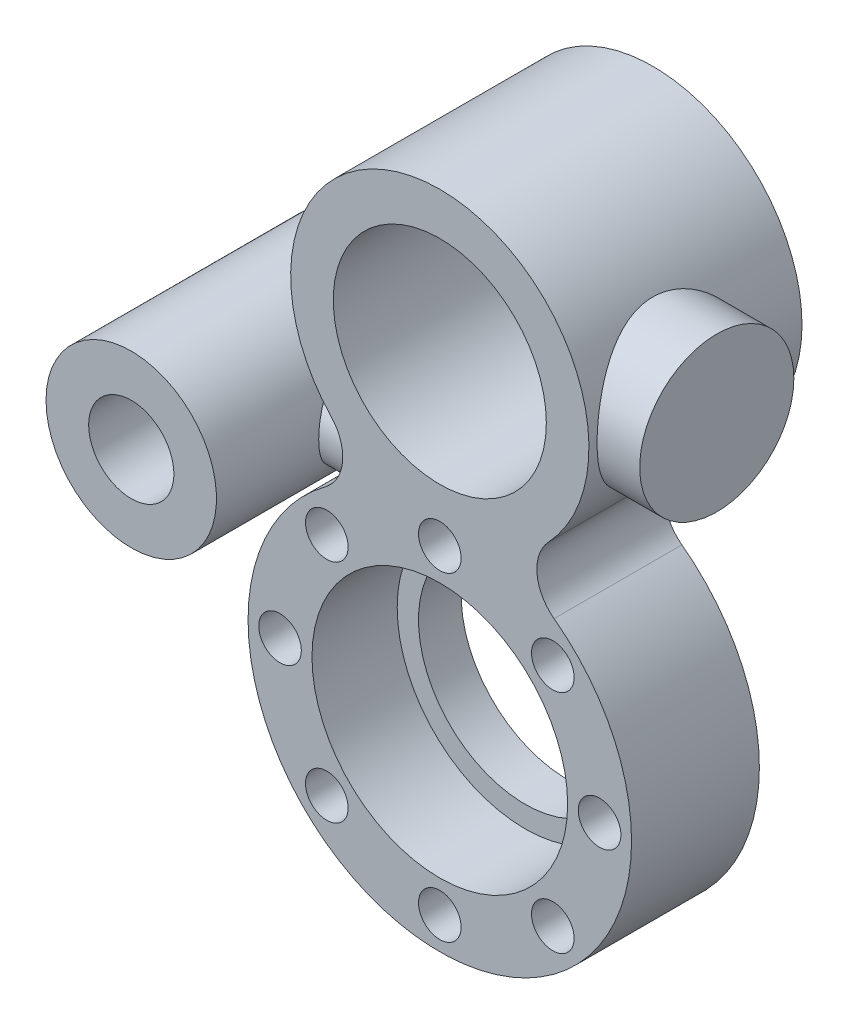
from build123d import *

# Parameters (mm, degrees)
MOTOR_START                     = -30
MOTOR_HOLDER_DEPTH              = 50
SKETCH11_R                      = 5
SCREW_HOLES_DEPTH               = 109.397416943
FILLET1_R                       = 10
BOSS_EXTRUDE4_DEPTH             = 10
BOSS_EXTRUDE4_DEPTH_BACK        = 10
SKETCH14_R                      = 18.090252651
BOSS_EXTRUDE5_REACH             = 122.52
SKETCH17_R                      = 10
BOSS_EXTRUDE5_DIRECTION_2_DEPTH = 1
BOSS_EXTRUDE6_DEPTH             = 10
BOSS_EXTRUDE6_DEPTH_BACK        = 44
SKETCH18_R                      = 20
SKETCH18_R_2                    = 10


with BuildPart() as part:
    # Sketch1 → motor holder (new body)
    with BuildSketch(Plane.XY.offset(MOTOR_START)):
        with BuildLine():
            Line((-35, 35), (-25, 35))
            ThreePointArc((-25, 35), (0, 10), (25, 35))
            Line((25, 35), (35, 35))
            ThreePointArc((35, 35), (0, 0), (-35, 35))
        make_face()
    motor_holder = extrude(amount=MOTOR_HOLDER_DEPTH)

    # Mirror1: motor holder across plane
    add(motor_holder.mirror(Plane(origin=(25, 35, -30), x_dir=(0, 0, 1), z_dir=(0, -1, 0))))

    # Sketch10 → bearing holder (revolve)
    with BuildSketch(Plane(origin=(0, 0, 0), x_dir=(0, 0, -1), z_dir=(1, 0, 0))):
        Polygon((-20, 5), (-20, -10), (0, -10), (0, -15), (10, -15), (10, 5), align=None)
    revolve(axis=Axis((0, -40, 67.918923046), (0, 0, -1)))

    # Sketch11 → screw holes (cut, through all)
    with BuildSketch(Plane.XY.offset(20)):
        with Locations((0, -77.5)):
            Circle(SKETCH11_R)
        with Locations((-26.516504294, -66.516504294)):
            Circle(SKETCH11_R)
        with Locations((-37.5, -40)):
            Circle(SKETCH11_R)
        with Locations((-26.516504294, -13.483495706)):
            Circle(SKETCH11_R)
        with Locations((0, -2.5)):
            Circle(SKETCH11_R)
        with Locations((26.516504294, -13.483495706)):
            Circle(SKETCH11_R)
        with Locations((37.5, -40)):
            Circle(SKETCH11_R)
        with Locations((26.516504294, -66.516504294)):
            Circle(SKETCH11_R)
    extrude(amount=-SCREW_HOLES_DEPTH, mode=Mode.SUBTRACT)

    # Fillet1
    fillet1_edges = [part.edges().sort_by_distance(p)[0] for p in [
        (-13.795127964, 2.833333333, 5),
        (13.795127964, 2.833333333, 5),
    ]]
    fillet(fillet1_edges, radius=FILLET1_R)

    # Sketch14 → Boss-Extrude4 (add, two sides: drawn at the far end of the back side and taken through both)
    with BuildSketch(Plane(origin=(35, 0, 0), x_dir=(0, 0, -1), z_dir=(1, 0, 0)).offset(-BOSS_EXTRUDE4_DEPTH_BACK)):
        with Locations((0, 35)):
            Circle(SKETCH14_R)
    extrude(amount=BOSS_EXTRUDE4_DEPTH + BOSS_EXTRUDE4_DEPTH_BACK)

    # Sketch17 → Boss-Extrude5 (add, up to next)
    with BuildSketch(Plane.ZY.offset(35), mode=Mode.PRIVATE) as boss_extrude5_sk1:
        with Locations((5.095876685, 0)):
            Circle(SKETCH17_R)
    boss_extrude5_tool1 = extrude(boss_extrude5_sk1.sketch, amount=-BOSS_EXTRUDE5_REACH, mode=Mode.PRIVATE) - part.part
    add(boss_extrude5_tool1.solids().sort_by_distance((-35, 0, 5.095877))[0])

    # Sketch17 → Boss-Extrude5 direction 2 (add)
    with BuildSketch(Plane.ZY.offset(35)):
        with Locations((5.095876685, 0)):
            Circle(SKETCH17_R)
    extrude(amount=BOSS_EXTRUDE5_DIRECTION_2_DEPTH)

    # Sketch18 → Boss-Extrude6 (add, two sides: drawn at the far end of the back side and taken through both)
    with BuildSketch(Plane(origin=(0, 0, -4.904123315), x_dir=(-1, 0, 0), z_dir=(0, 0, -1)).offset(-BOSS_EXTRUDE6_DEPTH_BACK)):
        with Locations((53.320508076, 0)):
            Circle(SKETCH18_R)
        with Locations((53.320508076, 0)):
            Circle(SKETCH18_R_2, mode=Mode.SUBTRACT)
    extrude(amount=BOSS_EXTRUDE6_DEPTH + BOSS_EXTRUDE6_DEPTH_BACK)


solid = part.part
